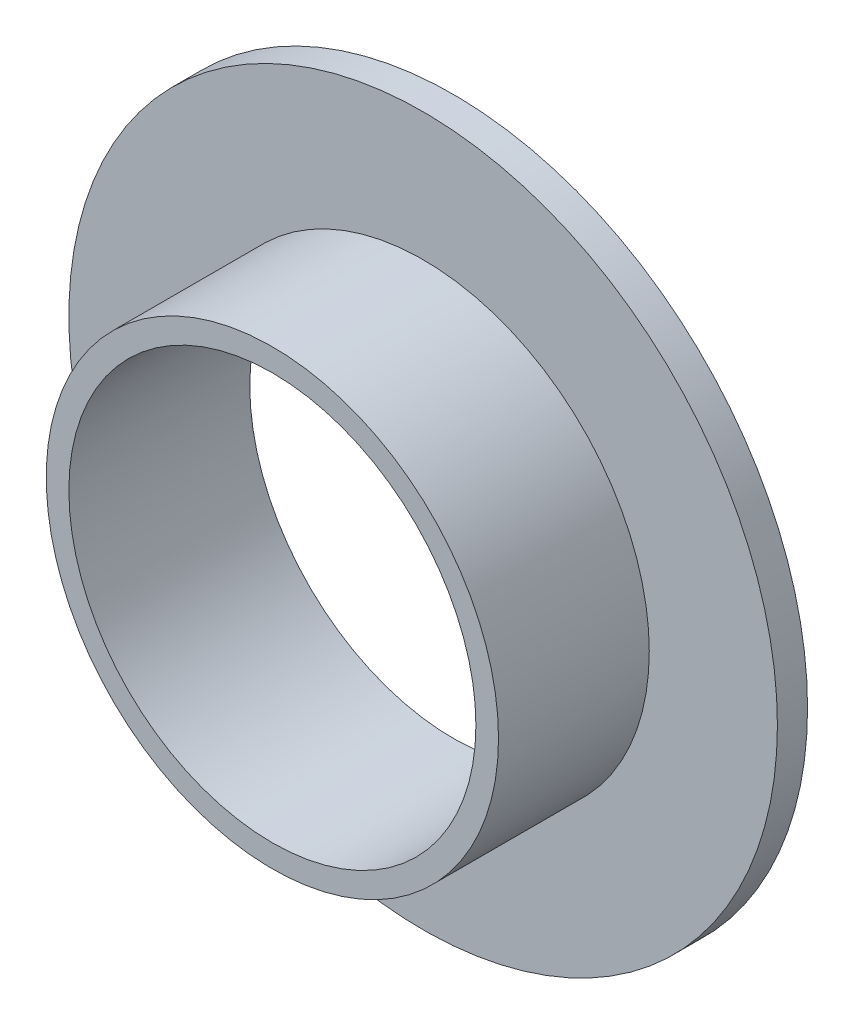
from build123d import *
from build123d.topology import SkipClean

# Parameters (mm, degrees)
SKETCH1_R           = 23.5
BOSS_EXTRUDE1_DEPTH = 2
SKETCH2_R           = 15
SKETCH2_R_2         = 13.5
BOSS_EXTRUDE2_DEPTH = 10
SKETCH4_R           = 13.5
CUT_EXTRUDE1_DEPTH  = 10


with BuildPart() as part:
    # Sketch1 → Boss-Extrude1 (new body)
    with BuildSketch(Plane.XY):
        Circle(SKETCH1_R)
    extrude(amount=BOSS_EXTRUDE1_DEPTH)

    # Sketch2 → Boss-Extrude2 (add)
    with BuildSketch(Plane.XY.offset(2)):
        Circle(SKETCH2_R)
        Circle(SKETCH2_R_2, mode=Mode.SUBTRACT)
    extrude(amount=BOSS_EXTRUDE2_DEPTH)

    # Sketch4 → Cut-Extrude1 (cut)
    with SkipClean():  # the faces are left unmerged after this step: merging them gives an invalid solid
        with BuildSketch(Plane(origin=(0, 0, 0), x_dir=(-1, 0, 0), z_dir=(0, 0, -1))):
            Circle(SKETCH4_R)
        extrude(amount=-CUT_EXTRUDE1_DEPTH, mode=Mode.SUBTRACT)


solid = part.part
